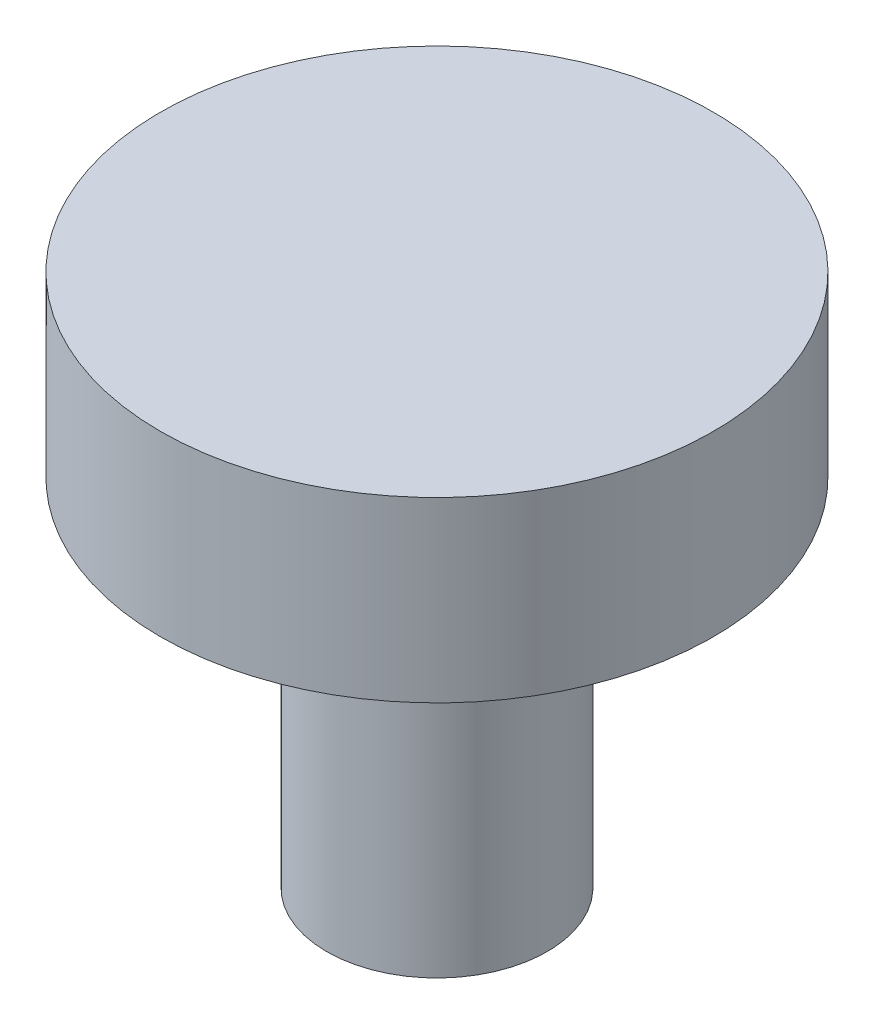
from build123d import *

# Parameters (mm, degrees)
SKETCH1_R           = 15.748
BOSS_EXTRUDE1_DEPTH = 50.8
SKETCH2_R           = 39.480990665
BOSS_EXTRUDE2_DEPTH = 25.4


with BuildPart() as part:
    # Sketch1 → Boss-Extrude1 (new body)
    with BuildSketch(Plane(origin=(0, 0, 0), x_dir=(1, 0, 0), z_dir=(0, 1, 0))):
        with Locations(Location((0, 0, 0), (0, 0, 270))):
            Circle(SKETCH1_R)
    extrude(amount=BOSS_EXTRUDE1_DEPTH)

    # Sketch2 → Boss-Extrude2 (add)
    with BuildSketch(Plane(origin=(0, 50.8, 0), x_dir=(1, 0, 0), z_dir=(0, 1, 0))):
        with Locations(Location((0, 0, 0), (0, 0, 270))):
            Circle(SKETCH2_R)
    extrude(amount=BOSS_EXTRUDE2_DEPTH)


solid = part.part
